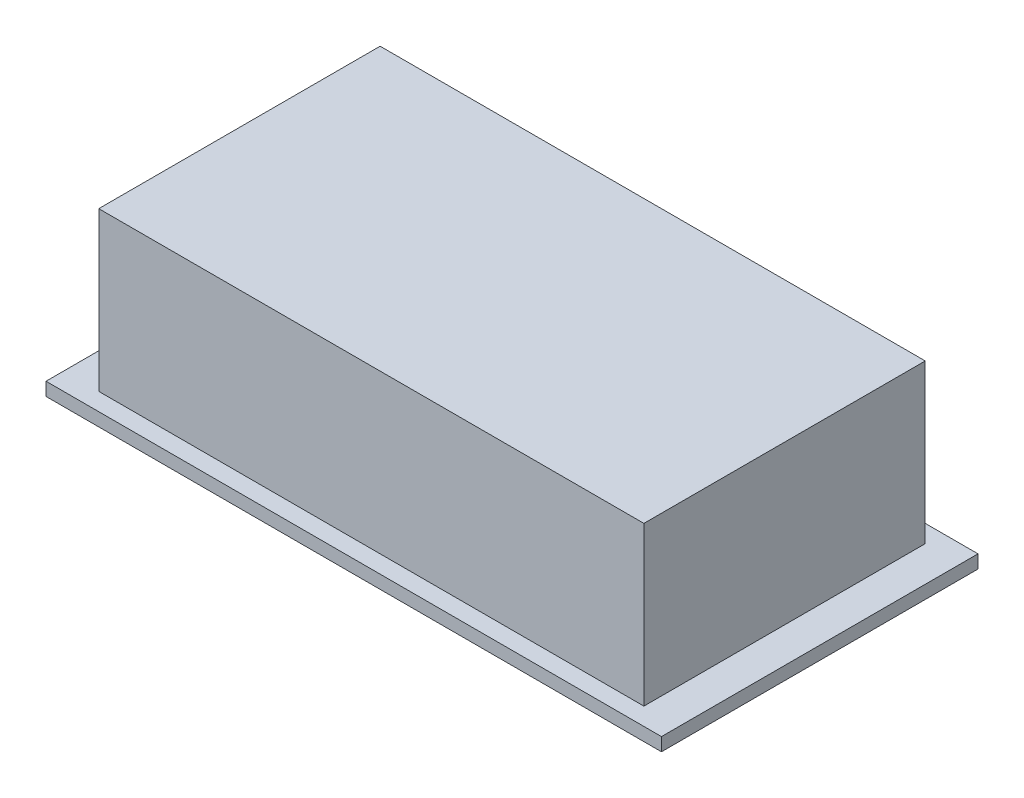
from build123d import *

# Parameters (mm, degrees)
SKETCH1_W           = 70
SKETCH1_H           = 36
BOSS_EXTRUDE1_DEPTH = 1.5
SKETCH2_W           = 62
SKETCH2_H           = 32
BOSS_EXTRUDE2_DEPTH = 18


with BuildPart() as part:
    # Sketch1 → Boss-Extrude1 (new body)
    with BuildSketch(Plane(origin=(0, 0, 0), x_dir=(1, 0, 0), z_dir=(0, 1, 0))):
        Rectangle(SKETCH1_W, SKETCH1_H)
    extrude(amount=BOSS_EXTRUDE1_DEPTH)

    # Sketch2 → Boss-Extrude2 (add)
    with BuildSketch(Plane(origin=(0, 1.5, 0), x_dir=(1, 0, 0), z_dir=(0, 1, 0))):
        Rectangle(SKETCH2_W, SKETCH2_H)
    extrude(amount=BOSS_EXTRUDE2_DEPTH)


solid = part.part
